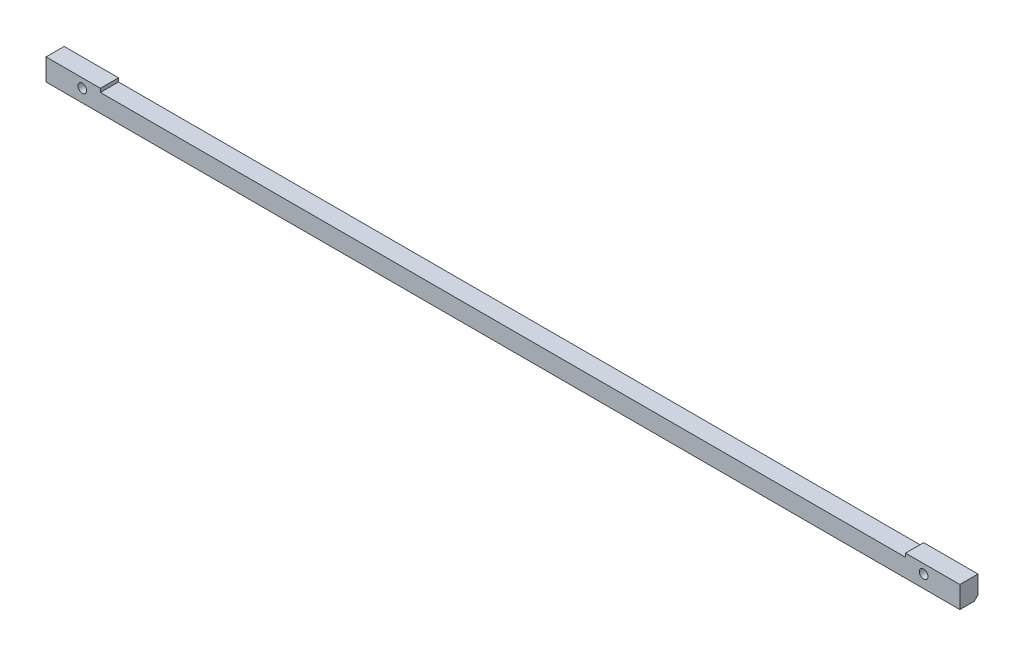
from build123d import *

# Parameters (mm, degrees)
EXTRUDE_1_DEPTH             = 5
CHAMFER_1_SIZE              = 1
HOLE_WIZARD_M21_D           = 2.4
HOLE_WIZARD_M21_CBORE_D     = 4.4
HOLE_WIZARD_M21_CBORE_DEPTH = 2.9


with BuildPart() as part:
    # Эскиз1 → Бобышка-Вытянуть1 (new body)
    with BuildSketch(Plane.XY):
        Polygon((-126, 0), (126, 0), (126, 6), (111, 6), (111, 5), (-111, 5), (-111, 6), (-126, 6), align=None)
    extrude(amount=EXTRUDE_1_DEPTH)

    # Фаска1
    chamfer_1_edges = [part.edges().sort_by_distance(p)[0] for p in [
        (0, 0, 0),
    ]]
    chamfer(chamfer_1_edges, length=CHAMFER_1_SIZE)

    # Цековка для  винта с внутренним шестигранником M21 (through all)
    with Locations(Plane(origin=(0, 0, 0), x_dir=(-1, 0, 0), z_dir=(0, 0, -1))):
        with Locations((-116, 3.5), (116, 3.5)):
            CounterBoreHole(HOLE_WIZARD_M21_D / 2, HOLE_WIZARD_M21_CBORE_D / 2, HOLE_WIZARD_M21_CBORE_DEPTH)


solid = part.part
